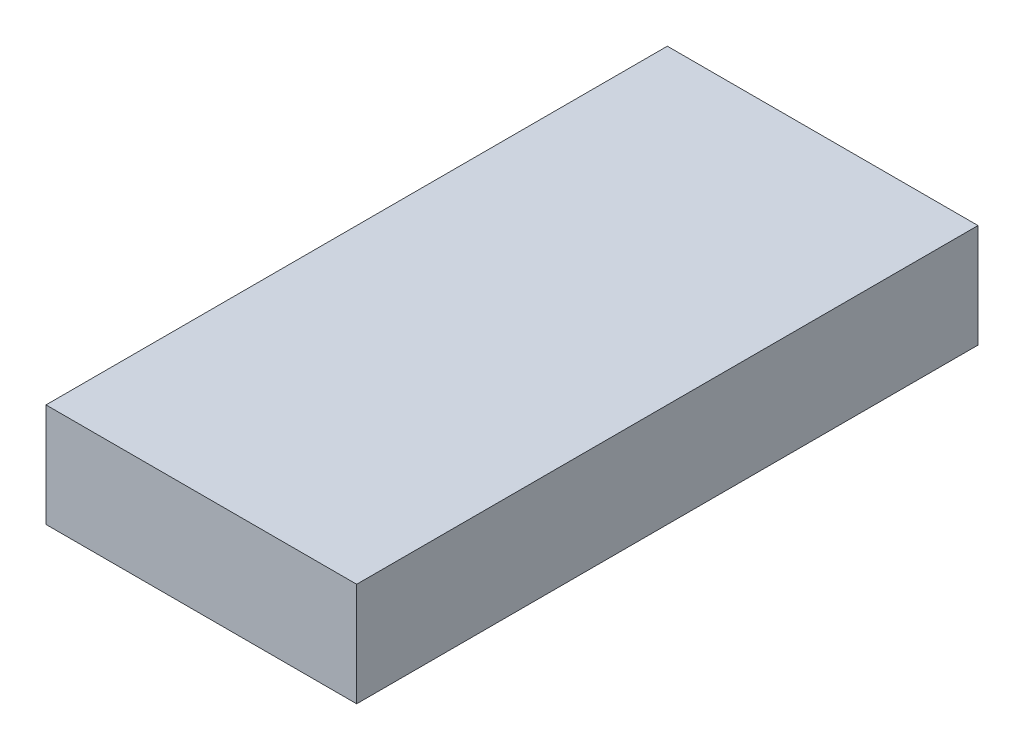
from build123d import *

# Parameters (mm, degrees)
SKETCH_1_W          = 30
SKETCH_1_H          = 60
EXTRUDE_1_DEPTH     = 10
SKETCH_2_R          = 2
CUT_EXTRUDE_1_DEPTH = 40


with BuildPart() as part:
    # 草图1 → 凸台-拉伸1 (new body)
    with BuildSketch(Plane(origin=(0, 0, 0), x_dir=(1, 0, 0), z_dir=(0, 1, 0))):
        Rectangle(SKETCH_1_W, SKETCH_1_H)
    extrude(amount=EXTRUDE_1_DEPTH)

    # 草图2 → 切除-拉伸1 (cut)
    with BuildSketch(Plane(origin=(0, 0, -30), x_dir=(-1, 0, 0), z_dir=(0, 0, -1))):
        with Locations((-7.5, 5)):
            Circle(SKETCH_2_R)
        with Locations(Location((7.5, 5, 0), (0, 0, 180))):
            Circle(SKETCH_2_R)
    extrude(amount=-CUT_EXTRUDE_1_DEPTH, mode=Mode.SUBTRACT)


solid = part.part
